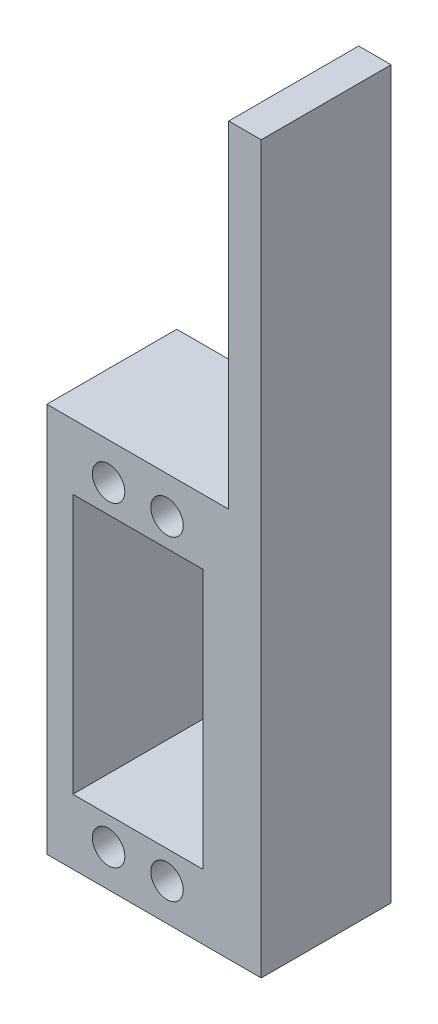
from build123d import *

# Parameters (mm, degrees)
ESBO_O1_R                = 2.5
ESBO_O1_W                = 20
ESBO_O1_H                = 40
RESSALTO_EXTRUS_O1_DEPTH = 20
RESSALTO_EXTRUS_O2_DEPTH = 20


with BuildPart() as part:
    # Esboço1 → Ressalto-extrusão1 (new body)
    with BuildSketch(Plane.XY):
        Polygon((2.323964608, -15.698616601), (-17.676035392, -15.698616601), (-21.676035392, -15.698616601), (-21.676035392, 34.301383399), (-21.676035392, 44.301383399), (6.323964608, 44.301383399), (6.323964608, 34.301383399), (6.323964608, -15.698616601), align=None)
        with Locations((-12.176035392, -9.998616601)):
            Circle(ESBO_O1_R, mode=Mode.SUBTRACT)
        with Locations((-3.176035392, -9.998616601)):
            Circle(ESBO_O1_R, mode=Mode.SUBTRACT)
        with Locations((-12.176035392, 38.601383399)):
            Circle(ESBO_O1_R, mode=Mode.SUBTRACT)
        with Locations((-3.176035392, 38.601383399)):
            Circle(ESBO_O1_R, mode=Mode.SUBTRACT)
        with Locations((-7.676035392, 14.301383399)):
            Rectangle(ESBO_O1_W, ESBO_O1_H, mode=Mode.SUBTRACT)
    extrude(amount=RESSALTO_EXTRUS_O1_DEPTH)

    # Esboço2 → Ressalto-extrusão2 (add)
    with BuildSketch(Plane(origin=(0, 0, 0), x_dir=(-1, 0, 0), z_dir=(0, 0, -1))):
        Polygon((-6.323964608, 44.301383399), (-6.323964608, -15.698616601), (-11.323964608, -15.698616601), (-11.323964608, 96.069751334), (-6.323964608, 96.069751334), align=None)
    extrude(amount=-RESSALTO_EXTRUS_O2_DEPTH)


solid = part.part
